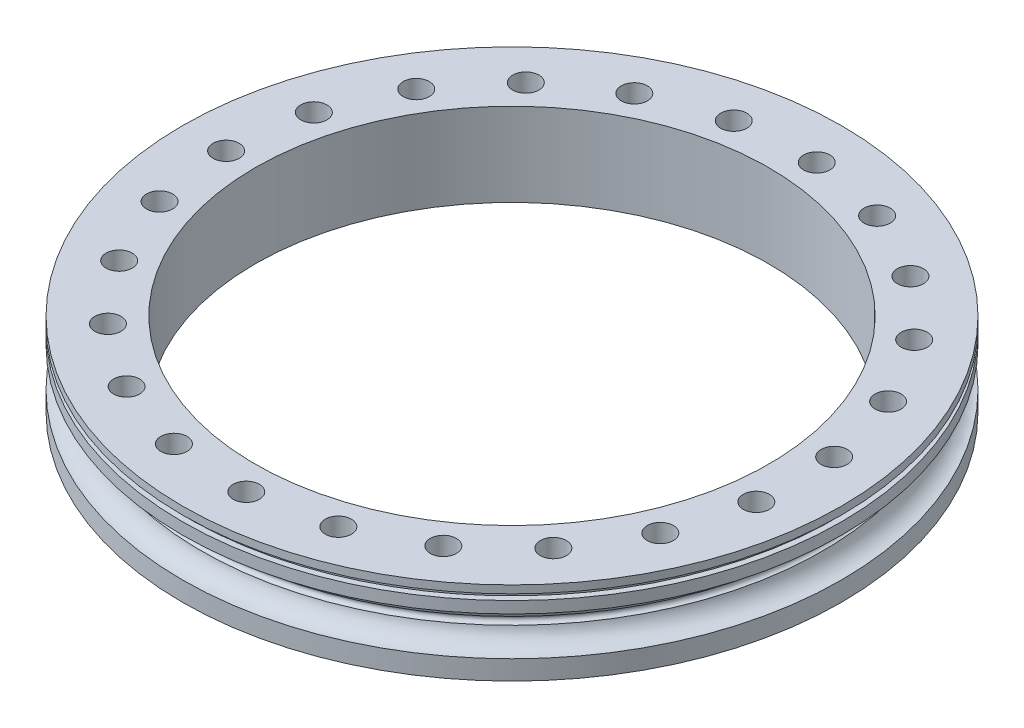
from build123d import *

# Parameters (mm, degrees)
ESQUISSE4_R                  = 6.75
ENL_V_MAT_EXTRU_2_DEPTH      = 245.231447607
R_P_TITION_CIRCULAIRE1_COUNT = 23


with BuildPart() as part:
    # Esquisse1 → Révolution1 (revolve)
    with BuildSketch(Plane.XY):
        with BuildLine():
            Line((-170, 43), (-170, 39))
            Line((-170, 39), (-167, 39))
            Line((-167, 39), (-167, 36))
            Line((-167, 36), (-170, 36))
            Line((-170, 36), (-170, 30))
            ThreePointArc((-170, 30), (-163.666348189, 27.738530528), (-160.197368421, 21.976970948))
            ThreePointArc((-160.197368421, 21.976970948), (-158.5, 20), (-160.197368421, 18.023029052))
            ThreePointArc((-160.197368421, 18.023029052), (-163.666348189, 12.261469472), (-170, 10))
            Line((-170, 10), (-170, 0))
            Line((-170, 0), (-132.5, 0))
            Line((-132.5, 0), (-132.5, 43))
            Line((-132.5, 43), (-170, 43))
        make_face()
    revolve(axis=Axis((0, 43, 0), (0, -1, 0)))

    # Esquisse4 → Enlèv. mat.-Extru.2 (cut, through all)
    with BuildSketch(Plane(origin=(0, 43, 0), x_dir=(1, 0, 0), z_dir=(0, 1, 0))):
        with Locations((-147.5, 0)):
            Circle(ESQUISSE4_R)
    enl_v_mat_extru_2 = extrude(amount=-ENL_V_MAT_EXTRU_2_DEPTH, mode=Mode.SUBTRACT)

    # Répétition circulaire1: Enlèv. mat.-Extru.2 ×23 about axis
    r_p_tition_circulaire1_axis = Axis((0, 45.15, 0), (0, -1, 0))
    for i in range(1, R_P_TITION_CIRCULAIRE1_COUNT):
        add(enl_v_mat_extru_2.rotate(r_p_tition_circulaire1_axis, i * 360 / R_P_TITION_CIRCULAIRE1_COUNT), mode=Mode.SUBTRACT)


solid = part.part
